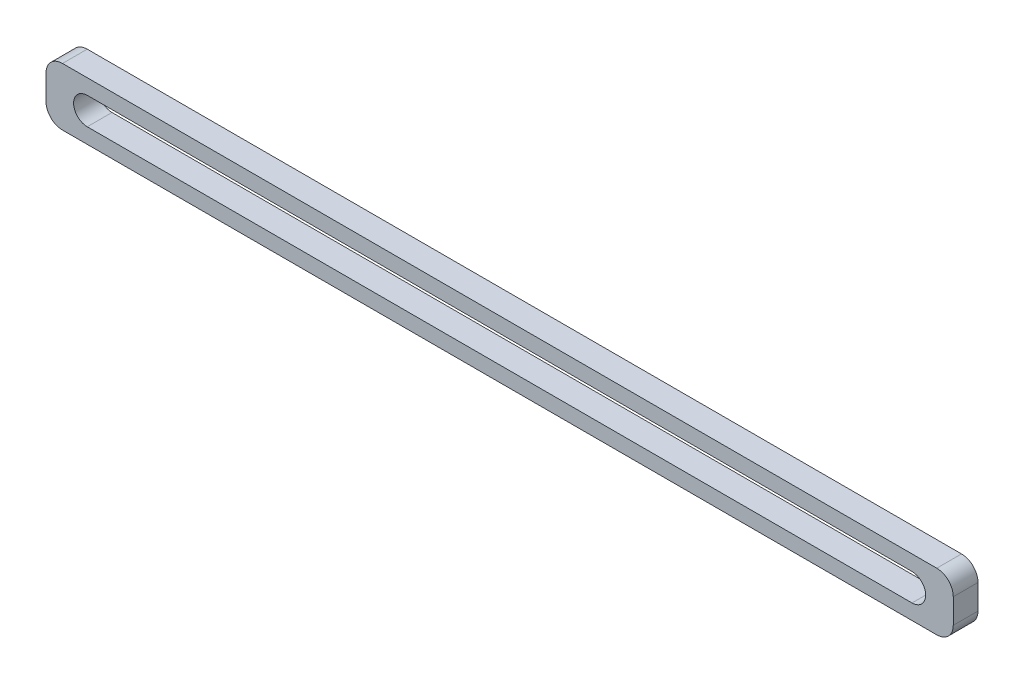
from build123d import *

# Parameters (mm, degrees)
SKETCH_1_W      = 110
SKETCH_1_H      = 7
EXTRUDE_1_DEPTH = 3
FILLET_1_R      = 2


with BuildPart() as part:
    # 草图1 → 凸台-拉伸1 (new body)
    with BuildSketch(Plane.XY):
        Rectangle(SKETCH_1_W, SKETCH_1_H)
        with BuildLine():
            Line((-50, 1.65), (50, 1.65))
            ThreePointArc((50, 1.65), (51.65, 0), (50, -1.65))
            Line((50, -1.65), (-50, -1.65))
            ThreePointArc((-50, -1.65), (-51.65, 0), (-50, 1.65))
        make_face(mode=Mode.SUBTRACT)
    extrude(amount=EXTRUDE_1_DEPTH)

    # 圆角1
    fillet_1_edges = [part.edges().sort_by_distance(p)[0] for p in [
        (55, -3.5, 1.5),
        (-55, -3.5, 1.5),
        (-55, 3.5, 1.5),
        (55, 3.5, 1.5),
    ]]
    fillet(fillet_1_edges, radius=FILLET_1_R)


solid = part.part
